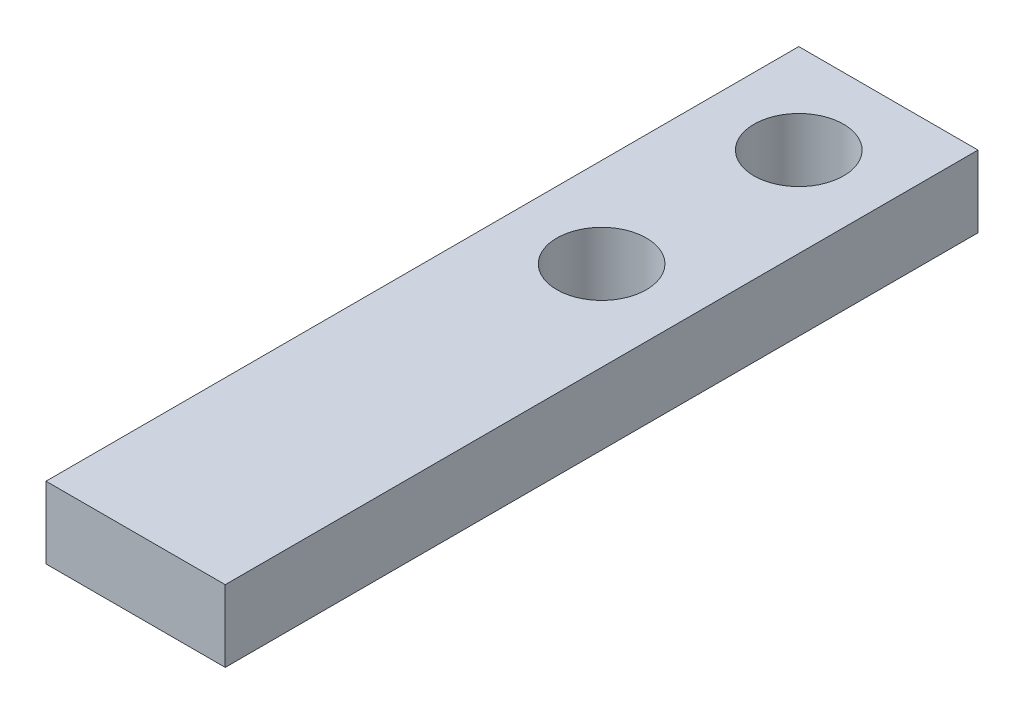
from build123d import *

# Parameters (mm, degrees)
SKETCH1_W           = 10
SKETCH1_H           = 42
SKETCH1_R           = 2.5
BOSS_EXTRUDE1_DEPTH = 4


with BuildPart() as part:
    # Sketch1 → Boss-Extrude1 (new body)
    with BuildSketch(Plane(origin=(0, 0, 0), x_dir=(1, 0, 0), z_dir=(0, 1, 0))):
        Rectangle(SKETCH1_W, SKETCH1_H)
        with Locations(Location((0, 16, 0), (0, 0, 270))):
            Circle(SKETCH1_R, mode=Mode.SUBTRACT)
        with Locations(Location((0, 5, 0), (0, 0, 270))):
            Circle(SKETCH1_R, mode=Mode.SUBTRACT)
    extrude(amount=BOSS_EXTRUDE1_DEPTH)


solid = part.part
